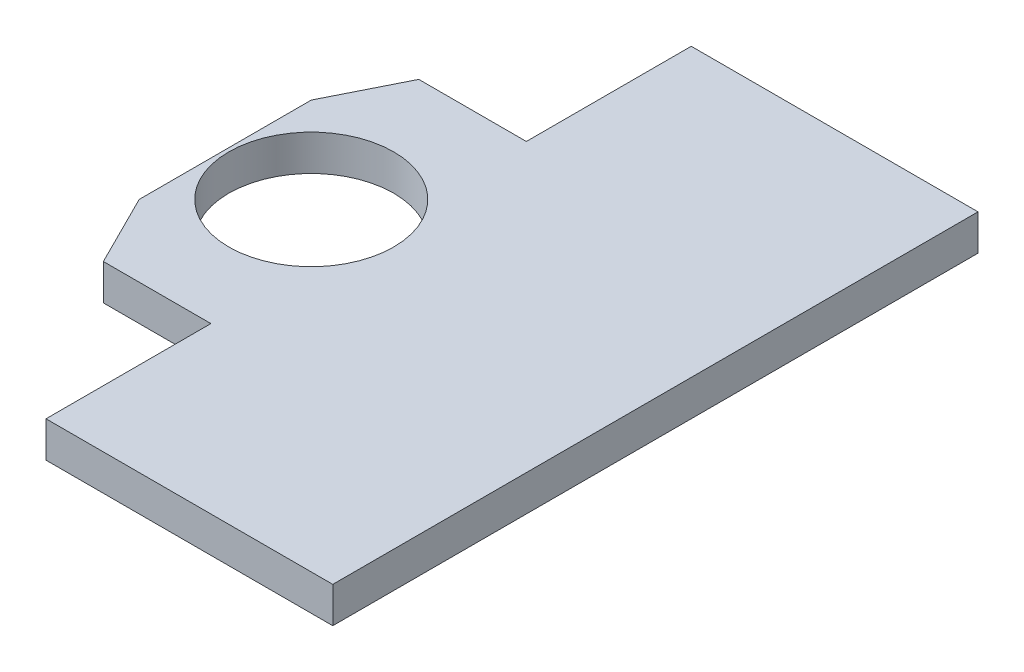
from build123d import *

# Parameters (mm, degrees)
SKETCH1_W           = 76.2
SKETCH1_H           = 114.3
SKETCH1_R           = 14.605
BOSS_EXTRUDE1_DEPTH = 6.35
CUT_EXTRUDE1_REACH  = 70.979
SKETCH2_W           = 25.4
SKETCH2_H           = 29.21
CUT_EXTRUDE3_REACH  = 70.979


with BuildPart() as part:
    # Sketch1 → Boss-Extrude1 (new body)
    with BuildSketch(Plane(origin=(0, 0, 0), x_dir=(1, 0, 0), z_dir=(0, 1, 0))):
        Rectangle(SKETCH1_W, SKETCH1_H)
        with Locations(Location((-22.86, 0, 0), (0, 0, 270))):
            Circle(SKETCH1_R, mode=Mode.SUBTRACT)
    extrude(amount=BOSS_EXTRUDE1_DEPTH)

    # Sketch2 → Cut-Extrude1 (cut, up to next)
    with BuildSketch(Plane(origin=(0, 6.35, 0), x_dir=(1, 0, 0), z_dir=(0, 1, 0)), mode=Mode.PRIVATE) as cut_extrude1_sk1:
        with Locations((-25.4, 42.545)):
            Rectangle(SKETCH2_W, SKETCH2_H)
    cut_extrude1_tool1 = extrude(cut_extrude1_sk1.sketch, amount=-CUT_EXTRUDE1_REACH, mode=Mode.PRIVATE) & part.part
    # Sketch2 → Cut-Extrude1 (cut, up to next)
    with BuildSketch(Plane(origin=(0, 6.35, 0), x_dir=(1, 0, 0), z_dir=(0, 1, 0)), mode=Mode.PRIVATE) as cut_extrude1_sk2:
        with Locations((-25.4, -42.545)):
            Rectangle(SKETCH2_W, SKETCH2_H)
    cut_extrude1_tool2 = extrude(cut_extrude1_sk2.sketch, amount=-CUT_EXTRUDE1_REACH, mode=Mode.PRIVATE) & part.part
    add(cut_extrude1_tool1.solids().sort_by_distance((-25.4, 6.35, -42.545))[0], mode=Mode.SUBTRACT)
    add(cut_extrude1_tool2.solids().sort_by_distance((-25.4, 6.35, 42.545))[0], mode=Mode.SUBTRACT)

    # Sketch4 → Cut-Extrude3 (cut, up to next)
    with BuildSketch(Plane(origin=(0, 6.35, 0), x_dir=(1, 0, 0), z_dir=(0, 1, 0)), mode=Mode.PRIVATE) as cut_extrude3_sk1:
        Polygon((-31.75, -27.94), (-38.1, -15.24), (-38.1, -27.94), align=None)
    cut_extrude3_tool1 = extrude(cut_extrude3_sk1.sketch, amount=-CUT_EXTRUDE3_REACH, mode=Mode.PRIVATE) & part.part
    # Sketch4 → Cut-Extrude3 (cut, up to next)
    with BuildSketch(Plane(origin=(0, 6.35, 0), x_dir=(1, 0, 0), z_dir=(0, 1, 0)), mode=Mode.PRIVATE) as cut_extrude3_sk2:
        Polygon((-31.75, 27.94), (-38.1, 27.94), (-38.1, 15.24), align=None)
    cut_extrude3_tool2 = extrude(cut_extrude3_sk2.sketch, amount=-CUT_EXTRUDE3_REACH, mode=Mode.PRIVATE) & part.part
    add(cut_extrude3_tool1.solids().sort_by_distance((-35.983333, 6.35, 23.706667))[0], mode=Mode.SUBTRACT)
    add(cut_extrude3_tool2.solids().sort_by_distance((-35.983333, 6.35, -23.706667))[0], mode=Mode.SUBTRACT)


solid = part.part
